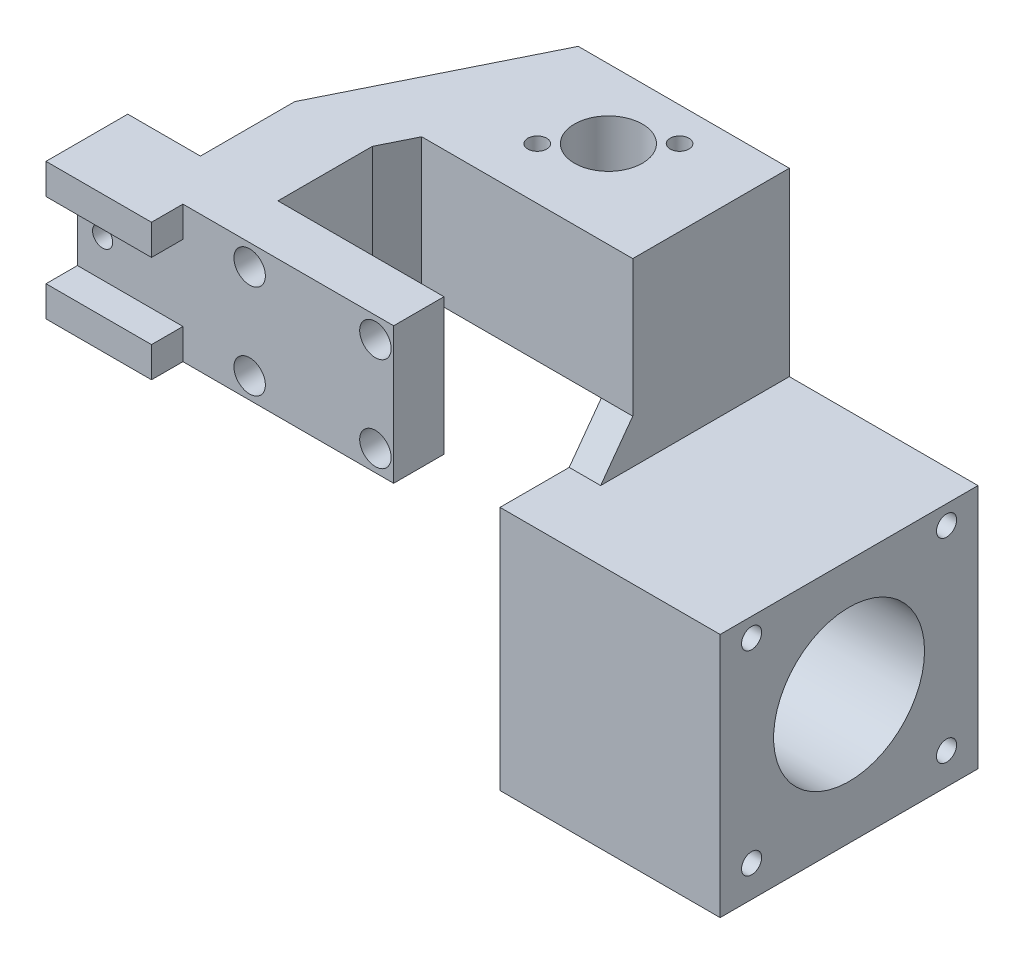
from build123d import *

# Parameters (mm, degrees)
SKICA1_W                 = 50.278910674
SKICA1_H                 = 21.7
SKICA1_R                 = 1.6
P_IDAT_VYSUNUT_M1_DEPTH  = 8
SKICA2_R                 = 2.5
ODEBRAT_VYSUNUT_M1_DEPTH = 4
SKICA3_R                 = 1.6
ODEBRAT_VYSUNUT_M2_DEPTH = 8
SKICA4_W                 = 12.327690559
SKICA4_H                 = 21.7
P_IDAT_VYSUNUT_M2_DEPTH  = 15
SKICA6_R                 = 5.406276896
P_IDAT_VYSUNUT_M3_DEPTH  = 21.7
SKICA7_R                 = 1.5
ODEBRAT_VYSUNUT_M3_DEPTH = 21.7
SKICA9_R                 = 1.6
SKICA9_R_2               = 12
P_IDAT_VYSUNUT_M4_DEPTH  = 5
SKICA10_W                = 41
SKICA10_H                = 39
SKICA10_R                = 12
SKICA10_R_2              = 1.6
P_IDAT_VYSUNUT_M5_DEPTH  = 30
SKICA11_W                = 16.773929501
SKICA11_H                = 4.85
P_IDAT_VYSUNUT_M6_DEPTH  = 5


with BuildPart() as part:
    # Skica1 → Přidat vysunutím1 (new body)
    with BuildSketch(Plane.XY):
        with Locations((-8.927473885, -9.09140889)):
            Rectangle(SKICA1_W, SKICA1_H)
        with Locations((13.311981452, -16.59140889)):
            Circle(SKICA1_R, mode=Mode.SUBTRACT)
        with Locations((-6.688018548, -16.59140889)):
            Circle(SKICA1_R, mode=Mode.SUBTRACT)
        with Locations((-6.688018548, -1.59140889)):
            Circle(SKICA1_R, mode=Mode.SUBTRACT)
        with Locations((13.311981452, -1.59140889)):
            Circle(SKICA1_R, mode=Mode.SUBTRACT)
    extrude(amount=P_IDAT_VYSUNUT_M1_DEPTH)

    # Skica2 → Odebrat vysunutím1 (cut)
    with BuildSketch(Plane.XY.offset(8)):
        with Locations((13.311981452, -16.59140889)):
            Circle(SKICA2_R)
        with Locations((-6.688018548, -16.59140889)):
            Circle(SKICA2_R)
        with Locations((-6.688018548, -1.59140889)):
            Circle(SKICA2_R)
        with Locations((13.311981452, -1.59140889)):
            Circle(SKICA2_R)
    extrude(amount=-ODEBRAT_VYSUNUT_M1_DEPTH, mode=Mode.SUBTRACT)

    # Skica3 → Odebrat vysunutím2 (cut)
    with BuildSketch(Plane.XY.offset(8)):
        with Locations((-30.066929222, -9.09140889)):
            Circle(SKICA3_R)
    extrude(amount=-ODEBRAT_VYSUNUT_M2_DEPTH, mode=Mode.SUBTRACT)

    # Skica4 → Přidat vysunutím2 (add)
    with BuildSketch(Plane(origin=(0, 0, 0), x_dir=(-1, 0, 0), z_dir=(0, 0, -1))):
        with Locations((16.351863828, -9.09140889)):
            Rectangle(SKICA4_W, SKICA4_H)
    extrude(amount=P_IDAT_VYSUNUT_M2_DEPTH)

    # Skica6 → Přidat vysunutím3 (add)
    with BuildSketch(Plane(origin=(0, 1.75859111, 0), x_dir=(1, 0, 0), z_dir=(0, 1, 0))):
        Polygon((-22.515709107, 15), (-10.188018548, 15), (-7.585826442, 20.254970434), (20.97371307, 20.254970434), (20.97371307, 45.15), (4.741864117, 45.15), (-7.585826442, 45.15), align=None)
        with Locations(Location((8.208247023, 34.15, 0), (0, 0, 270))):
            Circle(SKICA6_R, mode=Mode.SUBTRACT)
    extrude(amount=-P_IDAT_VYSUNUT_M3_DEPTH)

    # Skica7 → Odebrat vysunutím3 (cut)
    with BuildSketch(Plane.XZ.offset(19.94140889)):
        with Locations(Location((2.551392773, -28.493145751, 0), (0, 0, 270))):
            Circle(SKICA7_R)
        with Locations(Location((13.865101272, -39.806854249, 0), (0, 0, 270))):
            Circle(SKICA7_R)
    extrude(amount=-ODEBRAT_VYSUNUT_M3_DEPTH, mode=Mode.SUBTRACT)

    # Skica9 → Přidat vysunutím4 (add)
    with BuildSketch(Plane(origin=(20.97371307, 0, 0), x_dir=(0, 0, -1), z_dir=(1, 0, 0))):
        Polygon((45.15, 1.75859111), (20.254970434, 1.75859111), (20.254970434, -19.94140889), (15.15, -26.94140889), (4.15, -26.94140889), (4.15, -65.94140889), (15.15, -65.94140889), (45.15, -65.94140889), (45.15, -19.94140889), align=None)
        with Locations((40.15, -60.94140889)):
            Circle(SKICA9_R, mode=Mode.SUBTRACT)
        with Locations((9.15, -60.94140889)):
            Circle(SKICA9_R, mode=Mode.SUBTRACT)
        with Locations((9.15, -29.94140889)):
            Circle(SKICA9_R, mode=Mode.SUBTRACT)
        with Locations((40.15, -29.94140889)):
            Circle(SKICA9_R, mode=Mode.SUBTRACT)
        with Locations((24.65, -45.44140889)):
            Circle(SKICA9_R_2, mode=Mode.SUBTRACT)
    extrude(amount=P_IDAT_VYSUNUT_M4_DEPTH)

    # Skica10 → Přidat vysunutím5 (add)
    with BuildSketch(Plane(origin=(25.97371307, 0, 0), x_dir=(0, 0, -1), z_dir=(1, 0, 0))):
        with Locations((24.65, -46.44140889)):
            Rectangle(SKICA10_W, SKICA10_H)
        with Locations((24.65, -45.44140889)):
            Circle(SKICA10_R, mode=Mode.SUBTRACT)
        with Locations((40.15, -60.94140889)):
            Circle(SKICA10_R_2, mode=Mode.SUBTRACT)
        with Locations((40.15, -29.94140889)):
            Circle(SKICA10_R_2, mode=Mode.SUBTRACT)
        with Locations((9.15, -29.94140889)):
            Circle(SKICA10_R_2, mode=Mode.SUBTRACT)
        with Locations((9.15, -60.94140889)):
            Circle(SKICA10_R_2, mode=Mode.SUBTRACT)
    extrude(amount=P_IDAT_VYSUNUT_M5_DEPTH)

    # Skica11 → Přidat vysunutím6 (add)
    with BuildSketch(Plane.XY.offset(8)):
        with Locations((-25.679964471, -17.51640889)):
            Rectangle(SKICA11_W, SKICA11_H)
        with Locations((-25.679964471, -0.66640889)):
            Rectangle(SKICA11_W, SKICA11_H)
    extrude(amount=P_IDAT_VYSUNUT_M6_DEPTH)


solid = part.part
